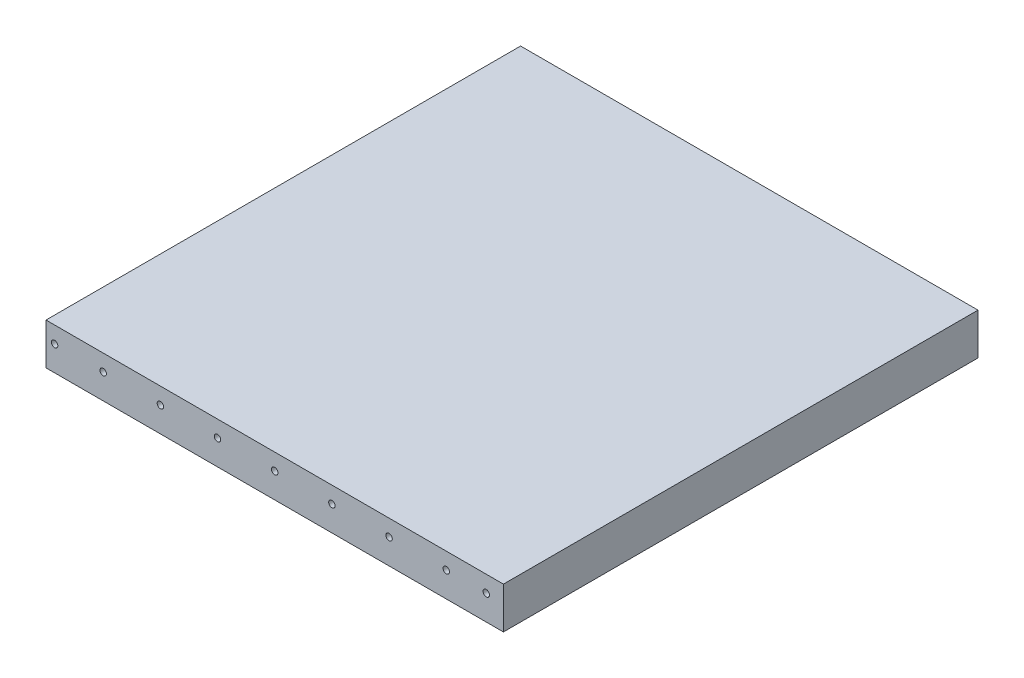
from build123d import *

# Parameters (mm, degrees)
SKETCH1_W           = 2032
SKETCH1_H           = 184.15
BOSS_EXTRUDE1_DEPTH = 2108.2
SKETCH2_R           = 14.2875
CUT_EXTRUDE1_DEPTH  = 2934.844314632


with BuildPart() as part:
    # Sketch1 → Boss-Extrude1 (new body)
    with BuildSketch(Plane.XY):
        with Locations((1016, 92.075)):
            Rectangle(SKETCH1_W, SKETCH1_H)
    extrude(amount=BOSS_EXTRUDE1_DEPTH)

    # Sketch2 → Cut-Extrude1 (cut, through all)
    with BuildSketch(Plane.XY):
        with Locations((38.1, 111.125)):
            Circle(SKETCH2_R)
        with Locations((254, 111.125)):
            Circle(SKETCH2_R)
        with Locations((508, 111.125)):
            Circle(SKETCH2_R)
        with Locations((762, 111.125)):
            Circle(SKETCH2_R)
        with Locations((1016, 111.125)):
            Circle(SKETCH2_R)
        with Locations((1270, 111.125)):
            Circle(SKETCH2_R)
        with Locations((1524, 111.125)):
            Circle(SKETCH2_R)
        with Locations((1778, 111.125)):
            Circle(SKETCH2_R)
        with Locations((1955.8, 111.125)):
            Circle(SKETCH2_R)
    extrude(amount=CUT_EXTRUDE1_DEPTH, mode=Mode.SUBTRACT)


solid = part.part
